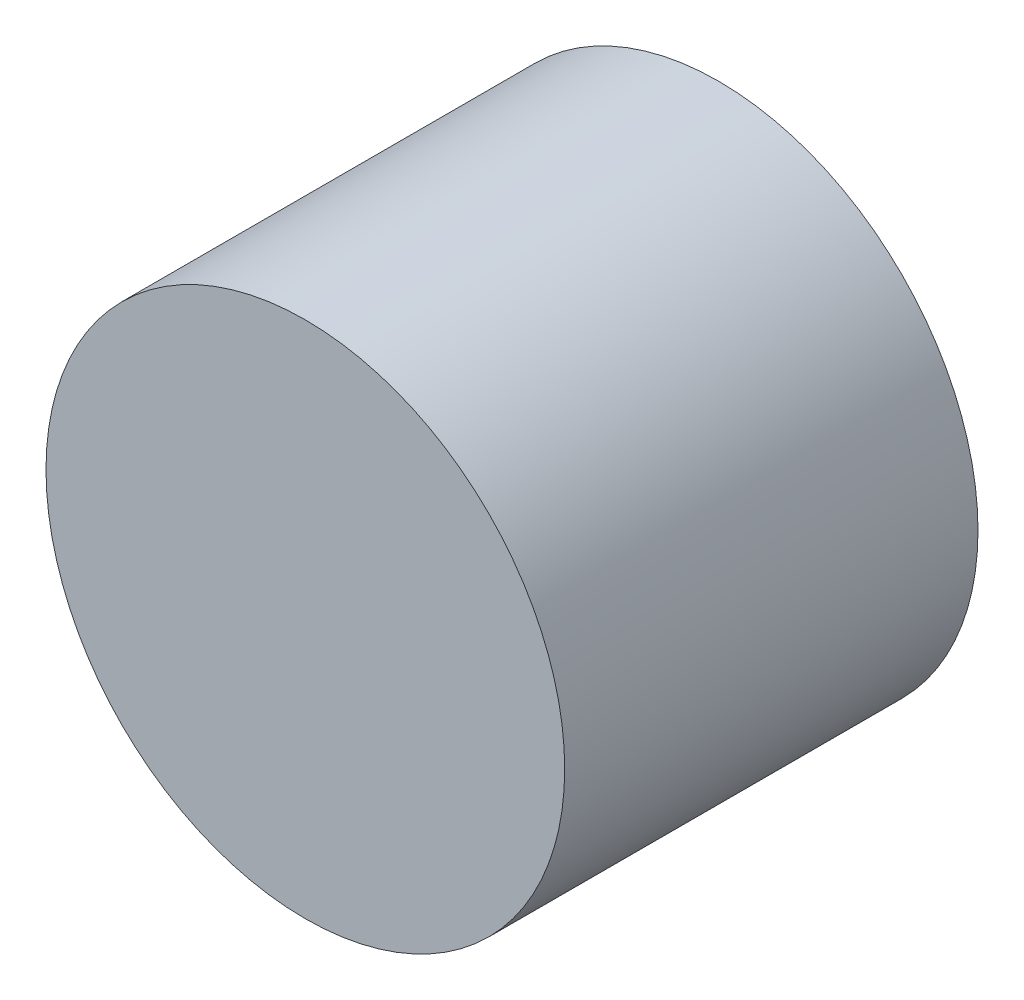
from build123d import *

# Parameters (mm, degrees)
SKETCH1_R           = 7.639
BOSS_EXTRUDE1_DEPTH = 12.173


with BuildPart() as part:
    # Sketch1 → Boss-Extrude1 (new body)
    with BuildSketch(Plane.XY):
        with Locations((-4.913, 6.281)):
            Circle(SKETCH1_R)
    extrude(amount=BOSS_EXTRUDE1_DEPTH)


solid = part.part
